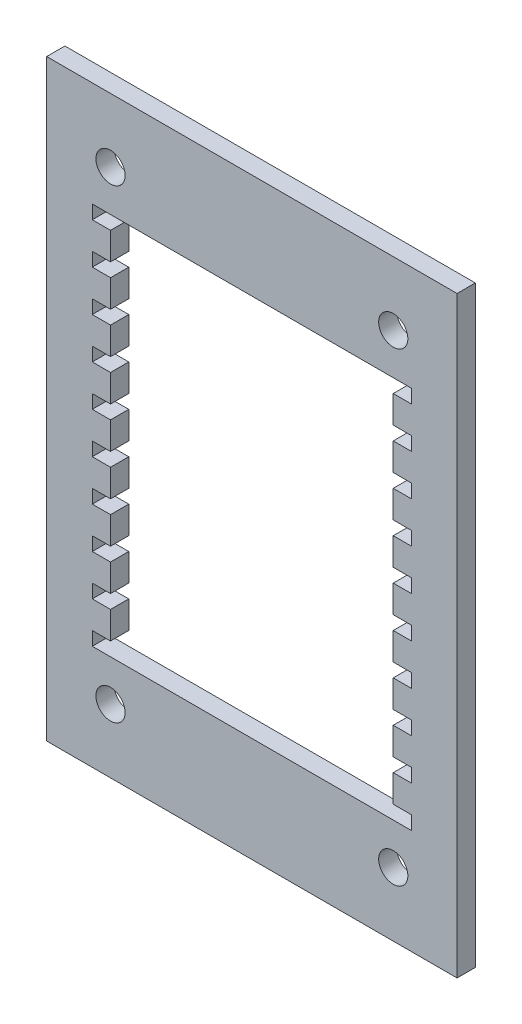
from build123d import *

# Parameters (mm, degrees)
SKIZZE1_W                       = 45
SKIZZE1_H                       = 65
AUFSATZ_LINEAR_AUSTRAGEN1_DEPTH = 2
SKIZZE3_W                       = 35
SKIZZE3_H                       = 42
SCHNITT_LINEAR_AUSTRAGEN1_DEPTH = 2
SKIZZE4_W                       = 2
SKIZZE4_H                       = 3
AUFSATZ_LINEAR_AUSTRAGEN2_DEPTH = 2
SKIZZE5_W                       = 2
SKIZZE5_H                       = 3
AUFSATZ_LINEAR_AUSTRAGEN3_DEPTH = 2
SKIZZE6_R                       = 1.6
SCHNITT_LINEAR_AUSTRAGEN2_DEPTH = 2


with BuildPart() as part:
    # Skizze1 → Aufsatz-Linear austragen1 (new body)
    with BuildSketch(Plane.XY):
        with Locations((22.5, 32.5)):
            Rectangle(SKIZZE1_W, SKIZZE1_H)
    extrude(amount=AUFSATZ_LINEAR_AUSTRAGEN1_DEPTH)

    # Skizze3 → Schnitt-Linear austragen1 (cut)
    with BuildSketch(Plane.XY.offset(2)):
        with Locations((22.5, 32.5)):
            Rectangle(SKIZZE3_W, SKIZZE3_H)
    extrude(amount=-SCHNITT_LINEAR_AUSTRAGEN1_DEPTH, mode=Mode.SUBTRACT)

    # Skizze4 → Aufsatz-Linear austragen2 (add)
    with BuildSketch(Plane(origin=(5, 0, 0), x_dir=(0, 0, -1), z_dir=(1, 0, 0))):
        with Locations((-1, 50.5)):
            Rectangle(SKIZZE4_W, SKIZZE4_H)
        with Locations((-1, 46)):
            Rectangle(SKIZZE4_W, SKIZZE4_H)
        with Locations((-1, 41.5)):
            Rectangle(SKIZZE4_W, SKIZZE4_H)
        with Locations((-1, 37)):
            Rectangle(SKIZZE4_W, SKIZZE4_H)
        with Locations((-1, 32.5)):
            Rectangle(SKIZZE4_W, SKIZZE4_H)
        with Locations((-1, 28)):
            Rectangle(SKIZZE4_W, SKIZZE4_H)
        with Locations((-1, 23.5)):
            Rectangle(SKIZZE4_W, SKIZZE4_H)
        with Locations((-1, 19)):
            Rectangle(SKIZZE4_W, SKIZZE4_H)
        with Locations((-1, 14.5)):
            Rectangle(SKIZZE4_W, SKIZZE4_H)
    extrude(amount=AUFSATZ_LINEAR_AUSTRAGEN2_DEPTH)

    # Skizze5 → Aufsatz-Linear austragen3 (add)
    with BuildSketch(Plane.ZY.offset(-40)):
        with Locations((1, 50.5)):
            Rectangle(SKIZZE5_W, SKIZZE5_H)
        with Locations((1, 46)):
            Rectangle(SKIZZE5_W, SKIZZE5_H)
        with Locations((1, 41.5)):
            Rectangle(SKIZZE5_W, SKIZZE5_H)
        with Locations((1, 37)):
            Rectangle(SKIZZE5_W, SKIZZE5_H)
        with Locations((1, 32.5)):
            Rectangle(SKIZZE5_W, SKIZZE5_H)
        with Locations((1, 28)):
            Rectangle(SKIZZE5_W, SKIZZE5_H)
        with Locations((1, 23.5)):
            Rectangle(SKIZZE5_W, SKIZZE5_H)
        with Locations((1, 19)):
            Rectangle(SKIZZE5_W, SKIZZE5_H)
        with Locations((1, 14.5)):
            Rectangle(SKIZZE5_W, SKIZZE5_H)
    extrude(amount=AUFSATZ_LINEAR_AUSTRAGEN3_DEPTH)

    # Skizze6 → Schnitt-Linear austragen2 (cut)
    with BuildSketch(Plane.XY.offset(2)):
        with Locations((7, 58)):
            Circle(SKIZZE6_R)
        with Locations((38, 58)):
            Circle(SKIZZE6_R)
        with Locations((38, 7)):
            Circle(SKIZZE6_R)
        with Locations((7, 7)):
            Circle(SKIZZE6_R)
    extrude(amount=-SCHNITT_LINEAR_AUSTRAGEN2_DEPTH, mode=Mode.SUBTRACT)


solid = part.part
